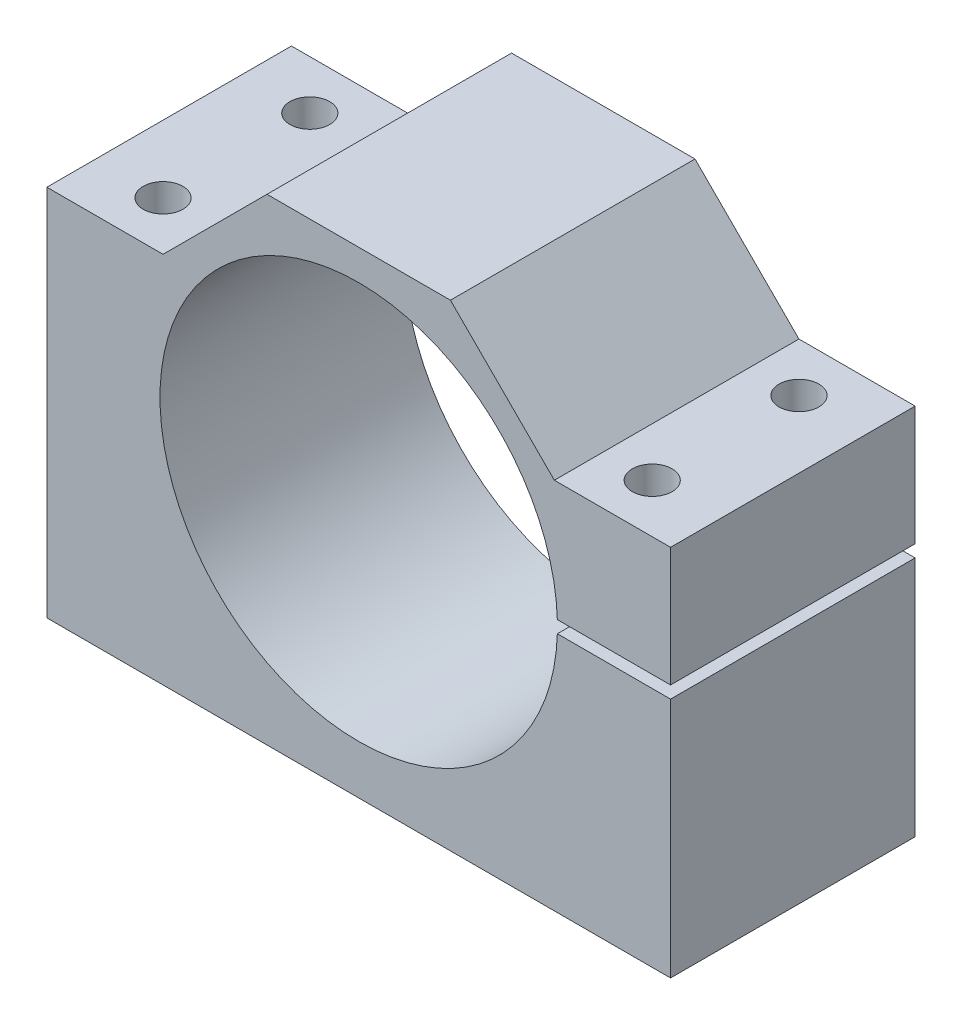
from build123d import *

# Parameters (mm, degrees)
EXTRUDE_1_DEPTH     = 40
SKETCH_2_R          = 3.25
CUT_EXTRUDE_1_DEPTH = 126.39936204


with BuildPart() as part:
    # 草图1 → 凸台-拉伸1 (new body)
    with BuildSketch(Plane.XY):
        with BuildLine():
            Line((0, 61), (19, 61))
            Line((19, 61), (36, 78))
            Line((36, 78), (66, 78))
            Line((66, 78), (83, 61))
            Line((83, 61), (102, 61))
            Line((102, 61), (102, 41.5))
            Line((102, 41.5), (83.484611742, 41.5))
            ThreePointArc((83.484611742, 41.5), (18.5, 40.5), (83.484611742, 39.5))
            Line((83.484611742, 39.5), (102, 39.5))
            Line((102, 39.5), (102, 0))
            Line((102, 0), (0, 0))
            Line((0, 0), (0, 61))
        make_face()
    extrude(amount=EXTRUDE_1_DEPTH)

    # 草图2 → 切除-拉伸1 (cut, through all)
    with BuildSketch(Plane(origin=(0, 61, 0), x_dir=(1, 0, 0), z_dir=(0, 1, 0))):
        with Locations(Location((11, -8, 0), (0, 0, 270))):
            Circle(SKETCH_2_R)
        with Locations(Location((11, -32, 0), (0, 0, 270))):
            Circle(SKETCH_2_R)
        with Locations(Location((91, -8, 0), (0, 0, 270))):
            Circle(SKETCH_2_R)
        with Locations(Location((91, -32, 0), (0, 0, 270))):
            Circle(SKETCH_2_R)
    extrude(amount=-CUT_EXTRUDE_1_DEPTH, mode=Mode.SUBTRACT)


solid = part.part
